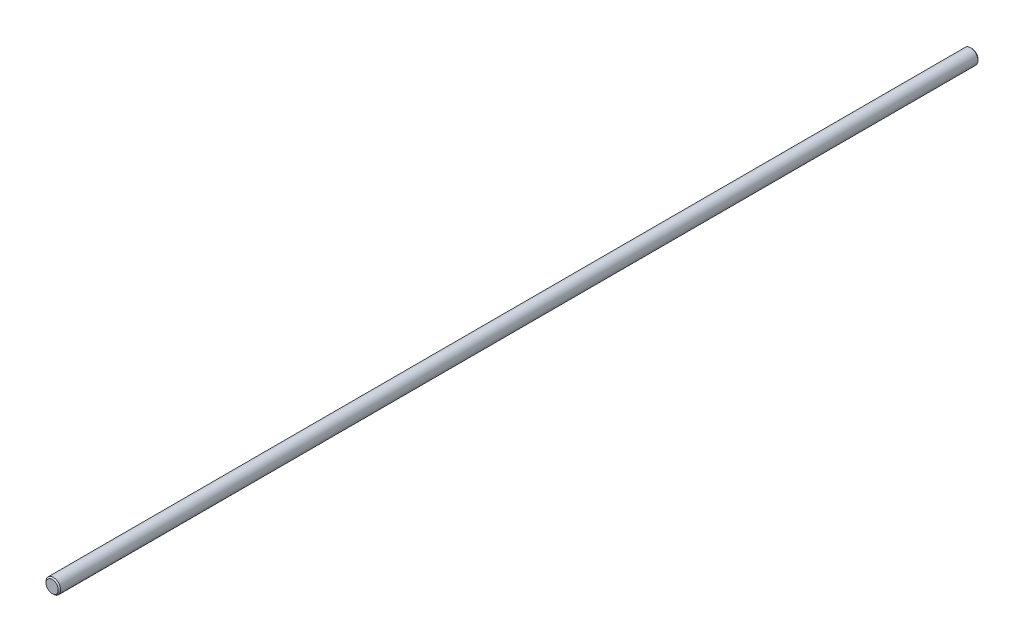
from build123d import *

# Parameters (mm, degrees)
SKETCH1_R          = 6
CORPO_DEPTH        = 750
CHANFROS_1X45_SIZE = 1


with BuildPart() as part:
    # Sketch1 → Corpo (new body)
    with BuildSketch(Plane.XY):
        Circle(SKETCH1_R)
    extrude(amount=-CORPO_DEPTH)

    # Chanfros 1x45°
    chanfros_1x45_edges = [part.edges().sort_by_distance(p)[0] for p in [
        (-6, 0, 0),
        (-6, 0, -750),
    ]]
    chamfer(chanfros_1x45_edges, length=CHANFROS_1X45_SIZE)


solid = part.part
